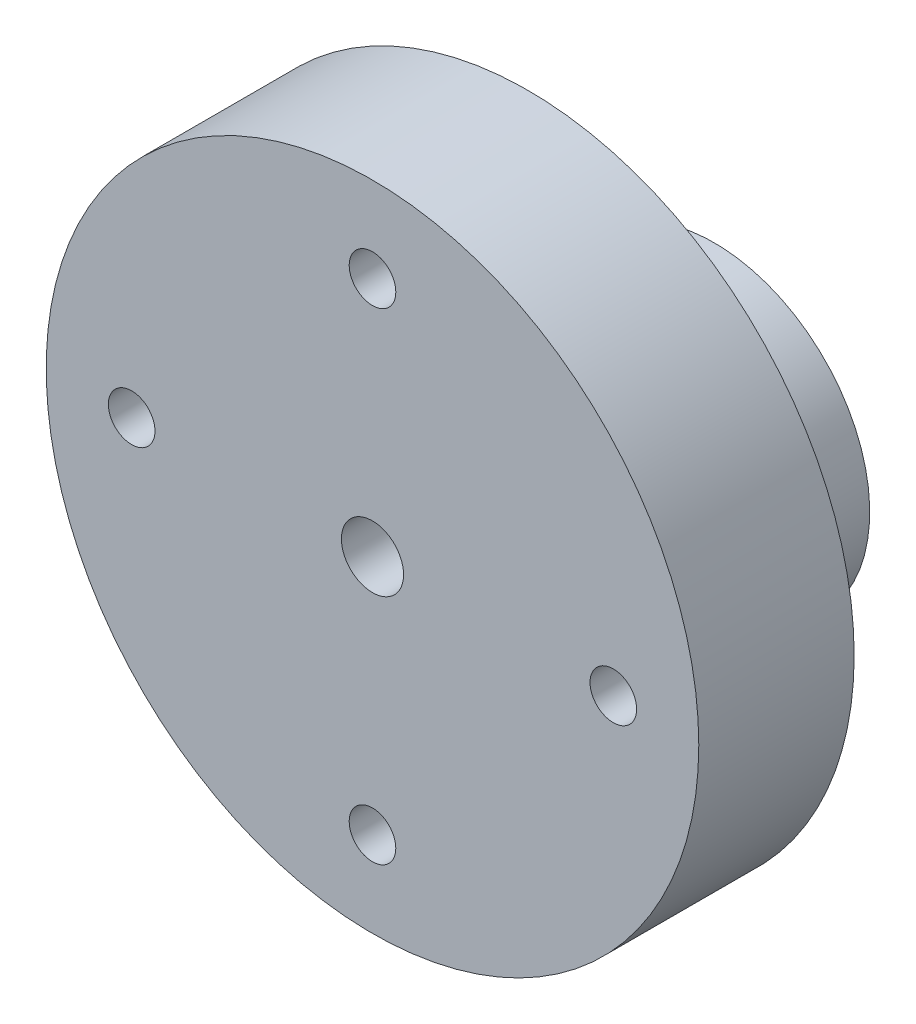
from build123d import *

# Parameters (mm, degrees)
SKETCH_1_R               = 21
SKETCH_1_R_2             = 1.5
EXTRUDE_1_DEPTH          = 10
SKETCH_2_R               = 14
EXTRUDE_2_DEPTH          = 3.5
SKETCH_3_R               = 10
EXTRUDE_3_DEPTH          = 8.5
SKETCH_5_R               = 2
CUT_EXTRUDE_1_DEPTH      = 28
SKETCH_4_R               = 1.4
CUT_EXTRUDE_2_DEPTH      = 9.5
CUT_EXTRUDE_3_DEPTH      = 15.5
CUT_EXTRUDE_3_DEPTH_BACK = 5.5
SKETCH_6_R               = 4


with BuildPart() as part:
    # 草图1 → 凸台-拉伸1 (new body)
    with BuildSketch(Plane.XY):
        Circle(SKETCH_1_R)
        with Locations((0, -15.5)):
            Circle(SKETCH_1_R_2, mode=Mode.SUBTRACT)
        with Locations((-15.5, 0)):
            Circle(SKETCH_1_R_2, mode=Mode.SUBTRACT)
        with Locations((0, 15.5)):
            Circle(SKETCH_1_R_2, mode=Mode.SUBTRACT)
        with Locations((15.5, 0)):
            Circle(SKETCH_1_R_2, mode=Mode.SUBTRACT)
    extrude(amount=EXTRUDE_1_DEPTH)

    # 草图2 → 凸台-拉伸2 (add)
    with BuildSketch(Plane(origin=(0, 0, 0), x_dir=(-1, 0, 0), z_dir=(0, 0, -1))):
        with Locations((0, -3.5)):
            Circle(SKETCH_2_R)
    extrude(amount=EXTRUDE_2_DEPTH)

    # 草图3 → 凸台-拉伸3 (add)
    with BuildSketch(Plane(origin=(0, 0, -3.5), x_dir=(-1, 0, 0), z_dir=(0, 0, -1))):
        with Locations((0, -3.5)):
            Circle(SKETCH_3_R)
    extrude(amount=EXTRUDE_3_DEPTH)

    # 草图5 → 切除-拉伸1 (cut)
    with BuildSketch(Plane.XY.offset(10)):
        Circle(SKETCH_5_R)
    extrude(amount=-CUT_EXTRUDE_1_DEPTH, mode=Mode.SUBTRACT)

    # 草图4 → 切除-拉伸2 (cut)
    with BuildSketch(Plane(origin=(0, 0, -12), x_dir=(-1, 0, 0), z_dir=(0, 0, -1))):
        with Locations((-6.5, 0)):
            Circle(SKETCH_4_R)
        with Locations(Location((6.5, 0, 0), (0, 0, 180))):
            Circle(SKETCH_4_R)
    extrude(amount=-CUT_EXTRUDE_2_DEPTH, mode=Mode.SUBTRACT)

    # 草图6 → 切除-拉伸3 (cut, two sides: drawn at the far end of the back side and taken through both)
    with BuildSketch(Plane(origin=(0, 0, 0), x_dir=(-1, 0, 0), z_dir=(0, 0, -1)).offset(-CUT_EXTRUDE_3_DEPTH_BACK)):
        with Locations(Location((0, 15.5, 0), (0, 0, 180))):
            Circle(SKETCH_6_R)
        with Locations(Location((15.5, 0, 0), (0, 0, 137.496782389))):
            Circle(SKETCH_6_R)
        with Locations(Location((0, -15.5, 0), (0, 0, 202.024312837))):
            Circle(SKETCH_6_R)
        with Locations(Location((-15.5, 0, 0), (0, 0, 292.048071018))):
            Circle(SKETCH_6_R)
    extrude(amount=CUT_EXTRUDE_3_DEPTH + CUT_EXTRUDE_3_DEPTH_BACK, mode=Mode.SUBTRACT)


solid = part.part
